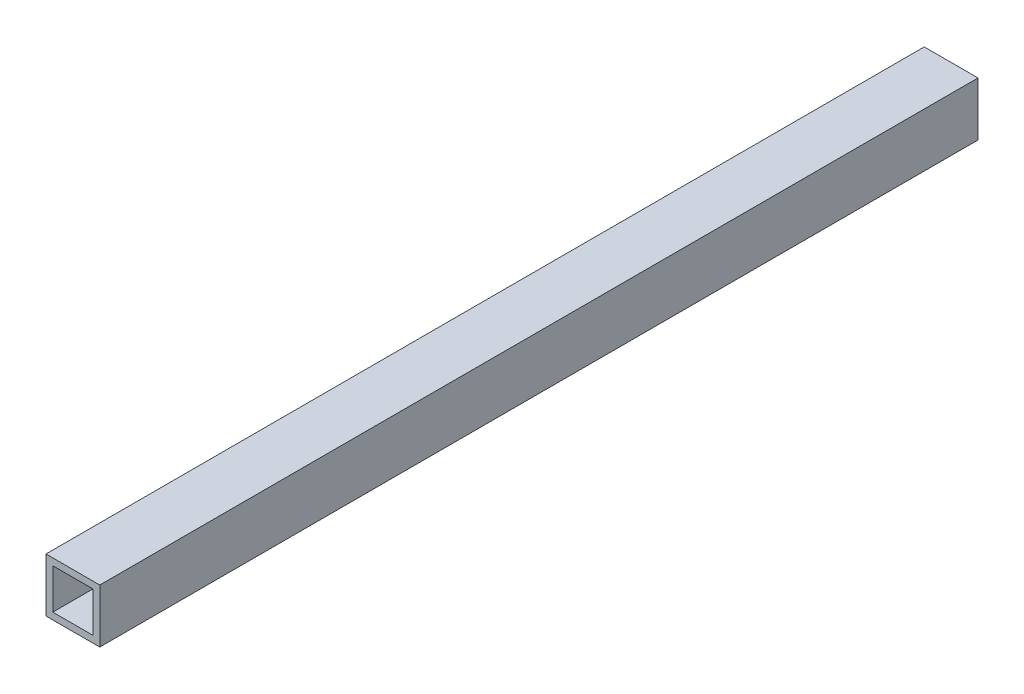
from build123d import *

# Parameters (mm, degrees)
SKETCH1_W           = 12.12
SKETCH1_H           = 12.12
SKETCH1_W_2         = 9.06
SKETCH1_H_2         = 9.06
BOSS_EXTRUDE1_DEPTH = 99


with BuildPart() as part:
    # Sketch1 → Boss-Extrude1 (new, symmetric)
    with BuildSketch(Plane.XY):
        Rectangle(SKETCH1_W, SKETCH1_H)
        Rectangle(SKETCH1_W_2, SKETCH1_H_2, mode=Mode.SUBTRACT)
    extrude(amount=BOSS_EXTRUDE1_DEPTH, both=True)


solid = part.part
